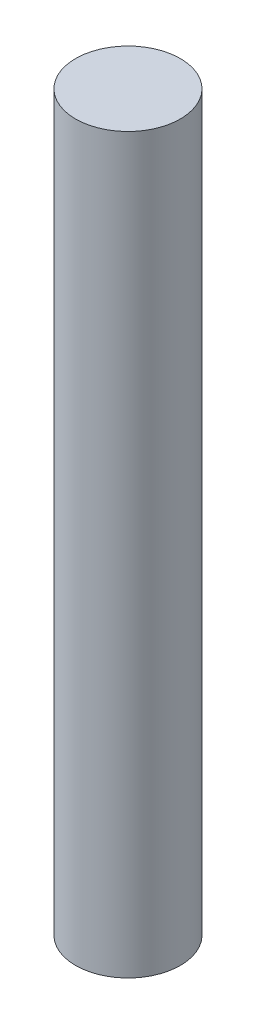
from build123d import *

# Parameters (mm, degrees)
SKETCH1_R           = 0.79375
BOSS_EXTRUDE1_DEPTH = 11.1125


with BuildPart() as part:
    # Sketch1 → Boss-Extrude1 (new body)
    with BuildSketch(Plane(origin=(0, 0, 0), x_dir=(1, 0, 0), z_dir=(0, 1, 0))):
        with Locations(Location((0, 0, 0), (0, 0, 270))):
            Circle(SKETCH1_R)
    extrude(amount=BOSS_EXTRUDE1_DEPTH)


solid = part.part
